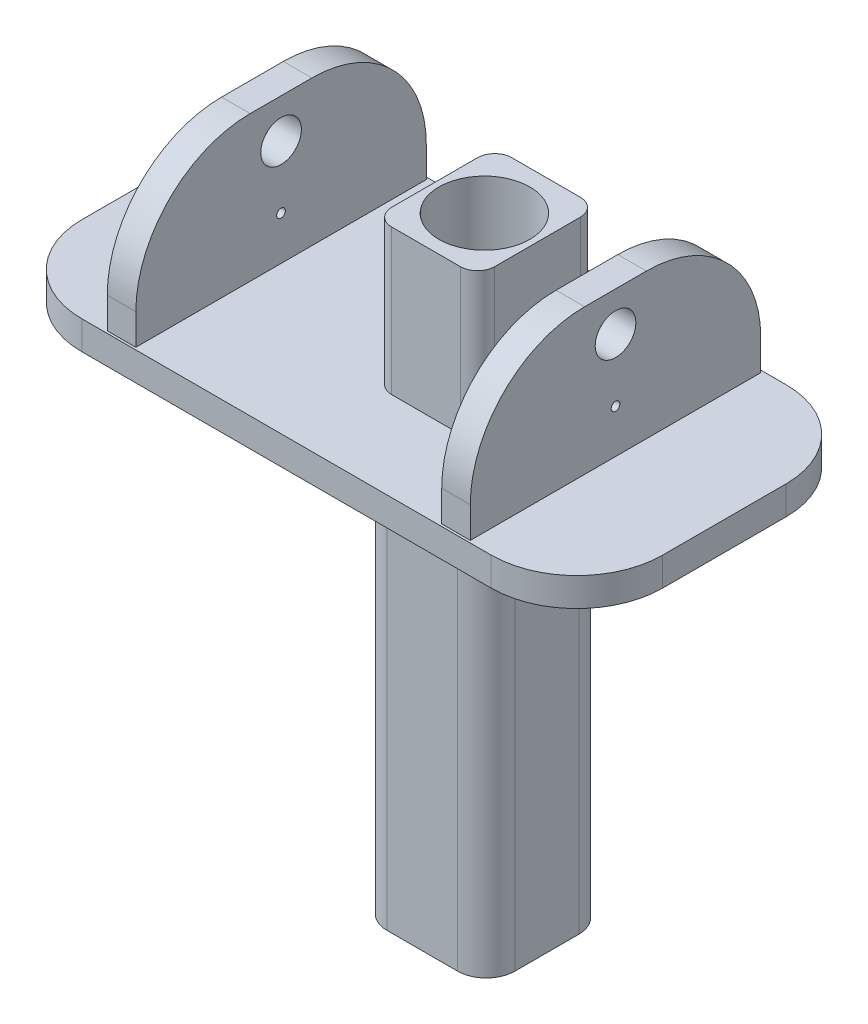
from build123d import *

# Parameters (mm, degrees)
SKETCH2_W           = 101.6
SKETCH2_H           = 101.6
BOSS_EXTRUDE2_DEPTH = 5
SKETCH3_W           = 5
SKETCH3_H           = 50.8
BOSS_EXTRUDE3_DEPTH = 25.4
SKETCH4_W           = 5
SKETCH4_H           = 50.8
BOSS_EXTRUDE4_DEPTH = 25.4
SKETCH8_R           = 3.556
CUT_EXTRUDE1_DEPTH  = 135.392047756
CUT_EXTRUDE2_REACH  = 136.392
SKETCH9_R           = 0.762
SKETCH11_R          = 7.9502
CUT_EXTRUDE3_DEPTH  = 146.911891222
CUT_EXTRUDE5_REACH  = 136.392
SKETCH18_R          = 0.762
SKETCH19_W          = 22.350467385
SKETCH19_H          = 21.198381437
BOSS_EXTRUDE5_DEPTH = 76.2
SKETCH22_R          = 7.94
CUT_EXTRUDE7_DEPTH  = 72.2
SKETCH23_R          = 4.95
CUT_EXTRUDE8_DEPTH  = 179.909697893
SKETCH24_W          = 101.6
SKETCH24_H          = 25
CUT_EXTRUDE9_DEPTH  = 166.041085794
SKETCH25_W          = 101.6
SKETCH25_H          = 25
CUT_EXTRUDE10_DEPTH = 166.041085794
FILLET1_R           = 20
FILLET2_R           = 20
FILLET3_R           = 20
FILLET4_R           = 20
FILLET5_R           = 15
FILLET6_R           = 15
FILLET7_R           = 15
FILLET8_R           = 15
FILLET9_R           = 5
FILLET10_R          = 5
FILLET11_R          = 5
FILLET12_R          = 5
SKETCH35_W          = 18
SKETCH35_H          = 21
BOSS_EXTRUDE7_DEPTH = 25.4
CUT_EXTRUDE12_REACH = 167.993
SKETCH36_R          = 7.95
FILLET18_R          = 3
FILLET19_R          = 3
FILLET20_R          = 3
FILLET21_R          = 3


with BuildPart() as part:
    # Sketch2 → Boss-Extrude2 (new body)
    with BuildSketch(Plane(origin=(0, 0, 0), x_dir=(1, 0, 0), z_dir=(0, 1, 0))):
        with Locations((50.8, -50.8)):
            Rectangle(SKETCH2_W, SKETCH2_H)
    extrude(amount=BOSS_EXTRUDE2_DEPTH)

    # Sketch3 → Boss-Extrude3 (add)
    with BuildSketch(Plane(origin=(0, 5, 0), x_dir=(1, 0, 0), z_dir=(0, 1, 0))):
        with Locations((21.55, -50.8)):
            Rectangle(SKETCH3_W, SKETCH3_H)
    extrude(amount=BOSS_EXTRUDE3_DEPTH)

    # Sketch4 → Boss-Extrude4 (add)
    with BuildSketch(Plane(origin=(0, 5, 0), x_dir=(1, 0, 0), z_dir=(0, 1, 0))):
        with Locations((80.05, -50.8)):
            Rectangle(SKETCH4_W, SKETCH4_H)
    extrude(amount=BOSS_EXTRUDE4_DEPTH)

    # Sketch8 → Cut-Extrude1 (cut, through all)
    with BuildSketch(Plane.ZY.offset(-19.05)):
        with Locations((50.8, 23.542)):
            Circle(SKETCH8_R)
    extrude(amount=-CUT_EXTRUDE1_DEPTH, mode=Mode.SUBTRACT)

    # Sketch9 → Cut-Extrude2 (cut, up to next)
    with BuildSketch(Plane(origin=(82.55, 0, 0), x_dir=(0, 0, -1), z_dir=(1, 0, 0)), mode=Mode.PRIVATE) as cut_extrude2_sk1:
        with Locations((-50.8, 12.62)):
            Circle(SKETCH9_R)
    cut_extrude2_tool1 = extrude(cut_extrude2_sk1.sketch, amount=-CUT_EXTRUDE2_REACH, mode=Mode.PRIVATE) & part.part
    add(cut_extrude2_tool1.solids().sort_by_distance((82.55, 12.62, 50.8))[0], mode=Mode.SUBTRACT)

    # Sketch11 → Cut-Extrude3 (cut, through all)
    with BuildSketch(Plane(origin=(0, 5, 0), x_dir=(1, 0, 0), z_dir=(0, 1, 0))):
        with Locations(Location((59.61, -50.8, 0), (0, 0, 270))):
            Circle(SKETCH11_R)
    extrude(amount=-CUT_EXTRUDE3_DEPTH, mode=Mode.SUBTRACT)

    # Sketch18 → Cut-Extrude5 (cut, up to next)
    with BuildSketch(Plane.ZY.offset(-19.05), mode=Mode.PRIVATE) as cut_extrude5_sk1:
        with Locations(Location((50.8, 12.62, 0), (0, 0, 180))):
            Circle(SKETCH18_R)
    cut_extrude5_tool1 = extrude(cut_extrude5_sk1.sketch, amount=-CUT_EXTRUDE5_REACH, mode=Mode.PRIVATE) & part.part
    add(cut_extrude5_tool1.solids().sort_by_distance((19.05, 12.62, 50.8))[0], mode=Mode.SUBTRACT)

    # Sketch19 → Boss-Extrude5 (add)
    with BuildSketch(Plane.XZ):
        with Locations((59.324658632, 50.761526183)):
            Rectangle(SKETCH19_W, SKETCH19_H)
    extrude(amount=BOSS_EXTRUDE5_DEPTH)

    # Sketch22 → Cut-Extrude7 (cut)
    with BuildSketch(Plane(origin=(0, 0, 0), x_dir=(1, 0, 0), z_dir=(0, 1, 0))):
        with Locations(Location((59.61, -50.8, 0), (0, 0, 270))):
            Circle(SKETCH22_R)
    extrude(amount=-CUT_EXTRUDE7_DEPTH, mode=Mode.SUBTRACT)

    # Sketch23 → Cut-Extrude8 (cut, through all)
    with BuildSketch(Plane.XZ.offset(76.2)):
        with Locations(Location((59.61, 50.8, 0), (0, 0, 270))):
            Circle(SKETCH23_R)
    extrude(amount=-CUT_EXTRUDE8_DEPTH, mode=Mode.SUBTRACT)

    # Sketch24 → Cut-Extrude9 (cut, through all)
    with BuildSketch(Plane(origin=(0, 5, 0), x_dir=(1, 0, 0), z_dir=(0, 1, 0))):
        with Locations((50.8, -12.5)):
            Rectangle(SKETCH24_W, SKETCH24_H)
    extrude(amount=-CUT_EXTRUDE9_DEPTH, mode=Mode.SUBTRACT)

    # Sketch25 → Cut-Extrude10 (cut, through all)
    with BuildSketch(Plane(origin=(0, 5, 0), x_dir=(1, 0, 0), z_dir=(0, 1, 0))):
        with Locations((50.8, -89.1)):
            Rectangle(SKETCH25_W, SKETCH25_H)
    extrude(amount=-CUT_EXTRUDE10_DEPTH, mode=Mode.SUBTRACT)

    # Fillet1
    fillet1_edges = [part.edges().sort_by_distance(p)[0] for p in [
        (21.55, 30.4, 76.2),
    ]]
    fillet(fillet1_edges, radius=FILLET1_R)

    # Fillet2
    fillet2_edges = [part.edges().sort_by_distance(p)[0] for p in [
        (21.55, 30.4, 25.4),
    ]]
    fillet(fillet2_edges, radius=FILLET2_R)

    # Fillet3
    fillet3_edges = [part.edges().sort_by_distance(p)[0] for p in [
        (80.05, 30.4, 25.4),
    ]]
    fillet(fillet3_edges, radius=FILLET3_R)

    # Fillet4
    fillet4_edges = [part.edges().sort_by_distance(p)[0] for p in [
        (80.05, 30.4, 76.2),
    ]]
    fillet(fillet4_edges, radius=FILLET4_R)

    # Fillet5
    fillet5_edges = [part.edges().sort_by_distance(p)[0] for p in [
        (101.6, 2.5, 76.6),
    ]]
    fillet(fillet5_edges, radius=FILLET5_R)

    # Fillet6
    fillet6_edges = [part.edges().sort_by_distance(p)[0] for p in [
        (101.6, 2.5, 25),
    ]]
    fillet(fillet6_edges, radius=FILLET6_R)

    # Fillet7
    fillet7_edges = [part.edges().sort_by_distance(p)[0] for p in [
        (0, 2.5, 25),
    ]]
    fillet(fillet7_edges, radius=FILLET7_R)

    # Fillet8
    fillet8_edges = [part.edges().sort_by_distance(p)[0] for p in [
        (0, 2.5, 76.6),
    ]]
    fillet(fillet8_edges, radius=FILLET8_R)

    # Fillet9
    fillet9_edges = [part.edges().sort_by_distance(p)[0] for p in [
        (70.499892324, -38.1, 61.360716901),
    ]]
    fillet(fillet9_edges, radius=FILLET9_R)

    # Fillet10
    fillet10_edges = [part.edges().sort_by_distance(p)[0] for p in [
        (70.499892324, -38.1, 40.162335464),
    ]]
    fillet(fillet10_edges, radius=FILLET10_R)

    # Fillet11
    fillet11_edges = [part.edges().sort_by_distance(p)[0] for p in [
        (48.149424939, -38.1, 61.360716901),
    ]]
    fillet(fillet11_edges, radius=FILLET11_R)

    # Fillet12
    fillet12_edges = [part.edges().sort_by_distance(p)[0] for p in [
        (48.149424939, -38.1, 40.162335464),
    ]]
    fillet(fillet12_edges, radius=FILLET12_R)

    # Sketch35 → Boss-Extrude7 (add)
    with BuildSketch(Plane(origin=(0, 5, 0), x_dir=(1, 0, 0), z_dir=(0, 1, 0))):
        with Locations((59.61, -50.5)):
            Rectangle(SKETCH35_W, SKETCH35_H)
    extrude(amount=BOSS_EXTRUDE7_DEPTH)

    # Sketch36 → Cut-Extrude12 (cut, up to next)
    with BuildSketch(Plane(origin=(0, 30.4, 0), x_dir=(1, 0, 0), z_dir=(0, 1, 0)), mode=Mode.PRIVATE) as cut_extrude12_sk1:
        with Locations(Location((59.61, -50.8, 0), (0, 0, 270))):
            Circle(SKETCH36_R)
    cut_extrude12_tool1 = extrude(cut_extrude12_sk1.sketch, amount=-CUT_EXTRUDE12_REACH, mode=Mode.PRIVATE) & part.part
    add(cut_extrude12_tool1.solids().sort_by_distance((59.61, 30.4, 50.8))[0], mode=Mode.SUBTRACT)

    # Fillet18
    fillet18_edges = [part.edges().sort_by_distance(p)[0] for p in [
        (50.61, 17.7, 61),
    ]]
    fillet(fillet18_edges, radius=FILLET18_R)

    # Fillet19
    fillet19_edges = [part.edges().sort_by_distance(p)[0] for p in [
        (68.61, 17.7, 61),
    ]]
    fillet(fillet19_edges, radius=FILLET19_R)

    # Fillet20
    fillet20_edges = [part.edges().sort_by_distance(p)[0] for p in [
        (68.61, 17.7, 40),
    ]]
    fillet(fillet20_edges, radius=FILLET20_R)

    # Fillet21
    fillet21_edges = [part.edges().sort_by_distance(p)[0] for p in [
        (50.61, 17.7, 40),
    ]]
    fillet(fillet21_edges, radius=FILLET21_R)


solid = part.part
